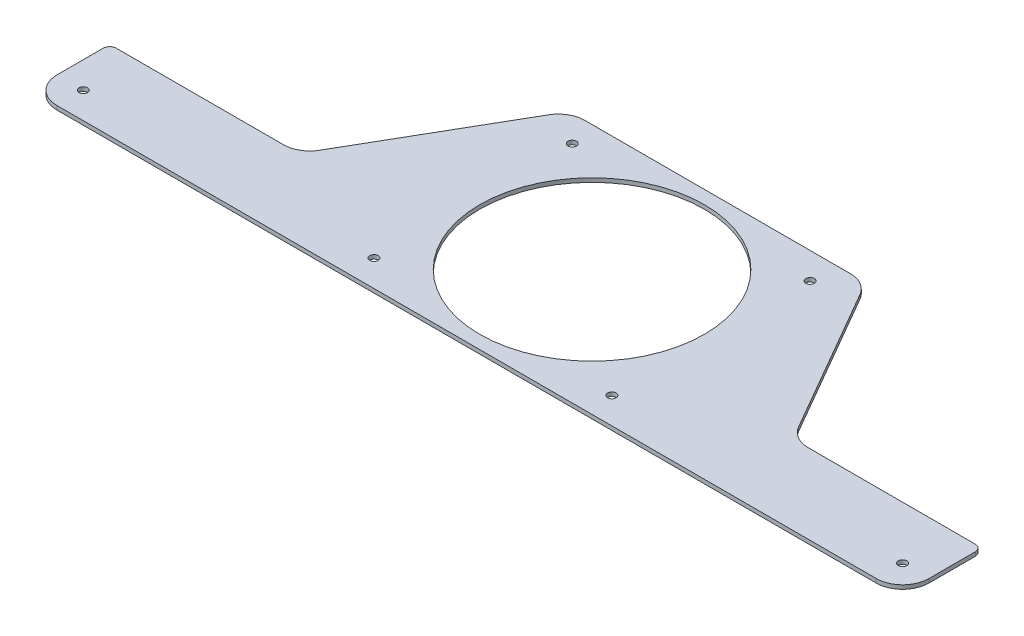
from build123d import *
from OCP.BRepFilletAPI import BRepFilletAPI_MakeFillet

# Parameters (mm, degrees)
ESQUISSE1_R             = 42.5
BOSS_EXTRU_1_DEPTH      = 1.5
CONG_1_R1               = 10
CONG_1_R2               = 2.5
ESQUISSE2_R             = 1.6
ENL_V_MAT_EXTRU_1_DEPTH = 172.707600298


with BuildPart() as part:
    # Esquisse1 → Boss.-Extru.1 (new body)
    with BuildSketch(Plane(origin=(0, 0, 0), x_dir=(1, 0, 0), z_dir=(0, 1, 0))):
        Polygon((56, 47.5), (-56, 47.5), (-93.527767497, -17.5), (-165, -17.5), (-165, -47.5), (165, -47.5), (165, -17.5), (93.527767497, -17.5), align=None)
        Circle(ESQUISSE1_R, mode=Mode.SUBTRACT)
    extrude(amount=BOSS_EXTRU_1_DEPTH)

    # Congé1: one fillet with a radius per group of edges: ONE call of the kernel's fillet builder (fillet() takes one radius for all edges)
    cong_1_edges_1 = [part.edges().sort_by_distance(p)[0] for p in [
        (-165, 0.75, 47.5),
        (165, 0.75, 47.5),
        (-93.527767497, 0.75, 17.5),
        (-56, 0.75, -47.5),
        (56, 0.75, -47.5),
        (93.527767497, 0.75, 17.5),
    ]]
    cong_1_edges_2 = [part.edges().sort_by_distance(p)[0] for p in [
        (165, 0.75, 17.5),
        (-165, 0.75, 17.5),
    ]]
    cong_1 = BRepFilletAPI_MakeFillet(part.part.solid().wrapped)
    for e in cong_1_edges_1:
        cong_1.Add(CONG_1_R1, e.wrapped)
    for e in cong_1_edges_2:
        cong_1.Add(CONG_1_R2, e.wrapped)
    add(Compound.cast(cong_1.Shape()), mode=Mode.REPLACE)

    # Esquisse2 → Enlèv. mat.-Extru.1 (cut, through all)
    with BuildSketch(Plane(origin=(0, 1.5, 0), x_dir=(1, 0, 0), z_dir=(0, 1, 0))):
        with Locations((-155, -37.5)):
            Circle(ESQUISSE2_R)
        with Locations((-45, -37.5)):
            Circle(ESQUISSE2_R)
        with Locations((-45, 37.5)):
            Circle(ESQUISSE2_R)
        with Locations((45, -37.5)):
            Circle(ESQUISSE2_R)
        with Locations((45, 37.5)):
            Circle(ESQUISSE2_R)
        with Locations((155, -37.5)):
            Circle(ESQUISSE2_R)
    extrude(amount=-ENL_V_MAT_EXTRU_1_DEPTH, mode=Mode.SUBTRACT)


solid = part.part
